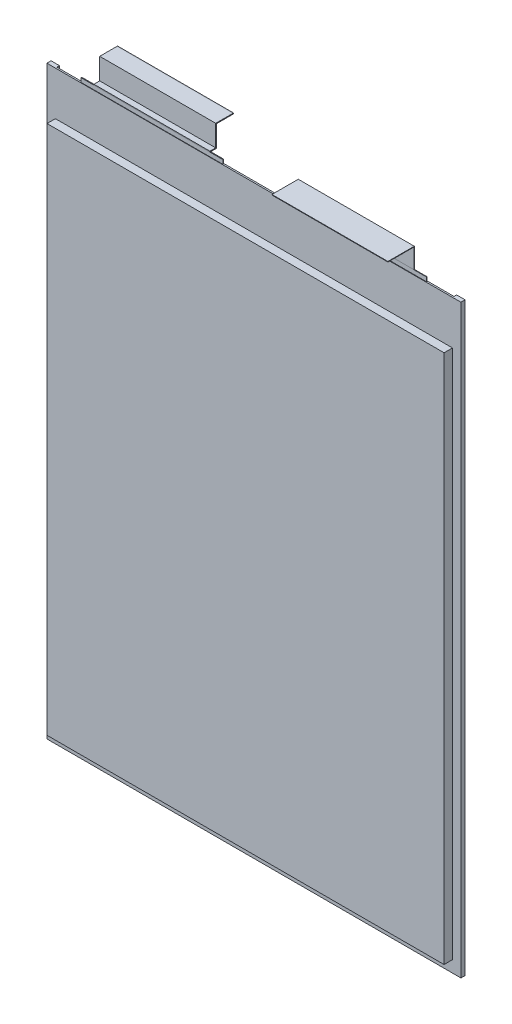
from build123d import *

# Parameters (mm, degrees)
INSULATION_DEPTH             = 0.3
INSULATION_DEPTH_BACK        = 0.3
SKETCH1_W                    = 160.6
SKETCH1_H                    = 227
MAIN_BODY_DEPTH              = 3.55
MAIN_BODY_DEPTH_BACK         = 3.55
SKETCH2_W                    = 154
SKETCH2_H                    = 205.5
SIDE_FOLDS_DEPTH             = 1.016
NEGATIVE_TAB_BASE_DEPTH      = 0.1
NEGATIVE_TAB_BASE_DEPTH_BACK = 0.1
SKETCH6_W                    = 55
SKETCH6_H                    = 18.6
POSITIVE_TAB_BASE_DEPTH      = 0.15
POSITIVE_TAB_BASE_DEPTH_BACK = 0.15
SKETCH7_W                    = 55
SKETCH7_H                    = 18.6
SKETCH113_W                  = 0.2
SKETCH113_H                  = 45
NEGATIVE_TAB_DEPTH           = 31.160222221
SKETCH113_ON_SEGMENT_2_W     = 0.2
SKETCH113_ON_SEGMENT_2_H     = 45
NEGATIVE_TAB_2_DEPTH         = 33.621222221
SKETCH110_W                  = 0.3
SKETCH110_H                  = 45
POSITIVE_TAB_DEPTH           = 23.650499994
SKETCH110_ON_SEGMENT_2_W     = 0.3
SKETCH110_ON_SEGMENT_2_H     = 45
POSITIVE_TAB_2_DEPTH         = 49.236449989
SKETCH110_ON_SEGMENT_3_W     = 0.3
SKETCH110_ON_SEGMENT_3_H     = 45
POSITIVE_TAB_3_DEPTH         = 55.260999989
SKETCH110_ON_SEGMENT_4_W     = 0.3
SKETCH110_ON_SEGMENT_4_H     = 45
POSITIVE_TAB_4_DEPTH         = 31.122574994
SKETCH110_ON_SEGMENT_5_W     = 0.3
SKETCH110_ON_SEGMENT_5_H     = 45
POSITIVE_TAB_5_DEPTH         = 1.15


with BuildPart() as part:
    # Sketch1 → Insulation (new, two sides: drawn at the far end of the back side and taken through both)
    with BuildSketch(Plane.XY.offset(-INSULATION_DEPTH_BACK)):
        Rectangle(SKETCH1_W, SKETCH1_H)
    extrude(amount=INSULATION_DEPTH + INSULATION_DEPTH_BACK)

    # Sketch2 → Main Body (add, two sides: drawn at the far end of the back side and taken through both)
    with BuildSketch(Plane.XY.offset(-MAIN_BODY_DEPTH_BACK)):
        with Locations((0, -6.25)):
            Rectangle(SKETCH2_W, SKETCH2_H)
    extrude(amount=MAIN_BODY_DEPTH + MAIN_BODY_DEPTH_BACK)

    # Sketch5 → Side Folds (add)
    with BuildSketch(Plane(origin=(0, 0, -0.3), x_dir=(-1, 0, 0), z_dir=(0, 0, -1))):
        Polygon((-77, -109), (-77, 96.5), (-77, 113.5), (-80.3, 113.5), (-80.3, -113.5), (-77, -113.5), align=None)
        Polygon((77, 113.5), (77, 96.5), (77, -109), (77, -113.5), (80.3, -113.5), (80.3, 113.5), align=None)
    extrude(amount=SIDE_FOLDS_DEPTH)

    # Sketch6 → Negative Tab Base (add, two sides: drawn at the far end of the back side and taken through both)
    with BuildSketch(Plane.XY.offset(-NEGATIVE_TAB_BASE_DEPTH_BACK)):
        with Locations((39.3, 105.8)):
            Rectangle(SKETCH6_W, SKETCH6_H)
    extrude(amount=NEGATIVE_TAB_BASE_DEPTH + NEGATIVE_TAB_BASE_DEPTH_BACK)

    # Sketch7 → Positive Tab Base (add, two sides: drawn at the far end of the back side and taken through both)
    with BuildSketch(Plane.XY.offset(-POSITIVE_TAB_BASE_DEPTH_BACK)):
        with Locations((-39.7, 105.8)):
            Rectangle(SKETCH7_W, SKETCH7_H)
    extrude(amount=POSITIVE_TAB_BASE_DEPTH + POSITIVE_TAB_BASE_DEPTH_BACK)


with BuildPart() as body_2:
    # Sketch113 → Negative Tab (new body)
    with BuildSketch(Plane(origin=(39.3, 115.1, 0), x_dir=(0, 0, -1), z_dir=(0, 1, 0))):
        Rectangle(SKETCH113_W, SKETCH113_H)
    extrude(amount=NEGATIVE_TAB_DEPTH)

    # Negative Tab mitre 1
    split(bisect_by=Plane(origin=(39.3, 122.76, 0), x_dir=(1, 0, 0), z_dir=(0, -0.707106781, -0.707106781)), keep=Keep.TOP)


with BuildPart() as body_3:
    # Sketch113 on segment 2 (carried to segment 2) → Negative Tab 2 (new body)
    with BuildSketch(Plane(origin=(39.3, 122.76, -23.500222221), x_dir=(0, 1, 0), z_dir=(0, 0, 1))):
        Rectangle(SKETCH113_ON_SEGMENT_2_W, SKETCH113_ON_SEGMENT_2_H)
    extrude(amount=NEGATIVE_TAB_2_DEPTH)

    # Negative Tab 2 mitre 1
    split(bisect_by=Plane(origin=(39.3, 122.76, 0), x_dir=(-1, 0, 0), z_dir=(0, 0.707106781, 0.707106781)), keep=Keep.TOP)


with BuildPart() as body_4:
    # Sketch110 → Positive Tab (new body)
    with BuildSketch(Plane(origin=(-39.7, 115.1, 0), x_dir=(0, 0, -1), z_dir=(0, 1, 0))):
        Rectangle(SKETCH110_W, SKETCH110_H)
    extrude(amount=POSITIVE_TAB_DEPTH)

    # Positive Tab mitre 1
    split(bisect_by=Plane(origin=(-39.7, 115.25, 0), x_dir=(1, 0, 0), z_dir=(0, -0.707106781, 0.707106781)), keep=Keep.TOP)


with BuildPart() as body_5:
    # Sketch110 on segment 2 (carried to segment 2) → Positive Tab 2 (new body)
    with BuildSketch(Plane(origin=(-39.7, 115.25, 23.500499994), x_dir=(0, -1, 0), z_dir=(0, 0, -1))):
        Rectangle(SKETCH110_ON_SEGMENT_2_W, SKETCH110_ON_SEGMENT_2_H)
    extrude(amount=POSITIVE_TAB_2_DEPTH)

    # Positive Tab 2 mitre 1
    split(bisect_by=Plane(origin=(-39.7, 115.25, 0), x_dir=(-1, 0, 0), z_dir=(0, 0.707106781, -0.707106781)), keep=Keep.TOP)

    # Positive Tab 2 mitre 2
    split(bisect_by=Plane(origin=(-39.7, 115.25, -2.23545), x_dir=(1, 0, 0), z_dir=(0, -0.707106781, 0.707106781)), keep=Keep.TOP)


with BuildPart() as body_6:
    # Sketch110 on segment 3 (carried to segment 3) → Positive Tab 3 (new body)
    with BuildSketch(Plane(origin=(-39.7, 91.749500006, -2.23545), x_dir=(0, 0, -1), z_dir=(0, 1, 0))):
        Rectangle(SKETCH110_ON_SEGMENT_3_W, SKETCH110_ON_SEGMENT_3_H)
    extrude(amount=POSITIVE_TAB_3_DEPTH)

    # Positive Tab 3 mitre 1
    split(bisect_by=Plane(origin=(-39.7, 115.25, -2.23545), x_dir=(-1, 0, 0), z_dir=(0, 0.707106781, -0.707106781)), keep=Keep.TOP)

    # Positive Tab 3 mitre 2
    split(bisect_by=Plane(origin=(-39.7, 123.51, -2.23545), x_dir=(1, 0, 0), z_dir=(0, -0.707106781, 0.707106781)), keep=Keep.TOP)


with BuildPart() as body_7:
    # Sketch110 on segment 4 (carried to segment 4) → Positive Tab 4 (new body)
    with BuildSketch(Plane(origin=(-39.7, 123.51, 21.265049994), x_dir=(0, -1, 0), z_dir=(0, 0, -1))):
        Rectangle(SKETCH110_ON_SEGMENT_4_W, SKETCH110_ON_SEGMENT_4_H)
    extrude(amount=POSITIVE_TAB_4_DEPTH)

    # Positive Tab 4 mitre 1
    split(bisect_by=Plane(origin=(-39.7, 123.51, -2.23545), x_dir=(-1, 0, 0), z_dir=(0, 0.707106781, -0.707106781)), keep=Keep.TOP)

    # Positive Tab 4 mitre 2
    split(bisect_by=Plane(origin=(-39.7, 123.51, -8.857525), x_dir=(0, -1, 0), z_dir=(0, 0, 1)), keep=Keep.TOP)


with BuildPart() as body_8:
    # Sketch110 on segment 5 (carried to segment 5) → Positive Tab 5 (new body)
    with BuildSketch(Plane(origin=(-39.7, 123.51, -7.857525), x_dir=(0, -1, 0), z_dir=(0, 0, -1))):
        Rectangle(SKETCH110_ON_SEGMENT_5_W, SKETCH110_ON_SEGMENT_5_H)
    extrude(amount=POSITIVE_TAB_5_DEPTH)

    # Positive Tab 5 mitre 1
    split(bisect_by=Plane(origin=(-39.7, 123.51, -8.857525), x_dir=(0, 1, 0), z_dir=(0, 0, -1)), keep=Keep.TOP)


solid = Compound([part.part, body_2.part, body_3.part, body_4.part, body_5.part, body_6.part, body_7.part, body_8.part])
